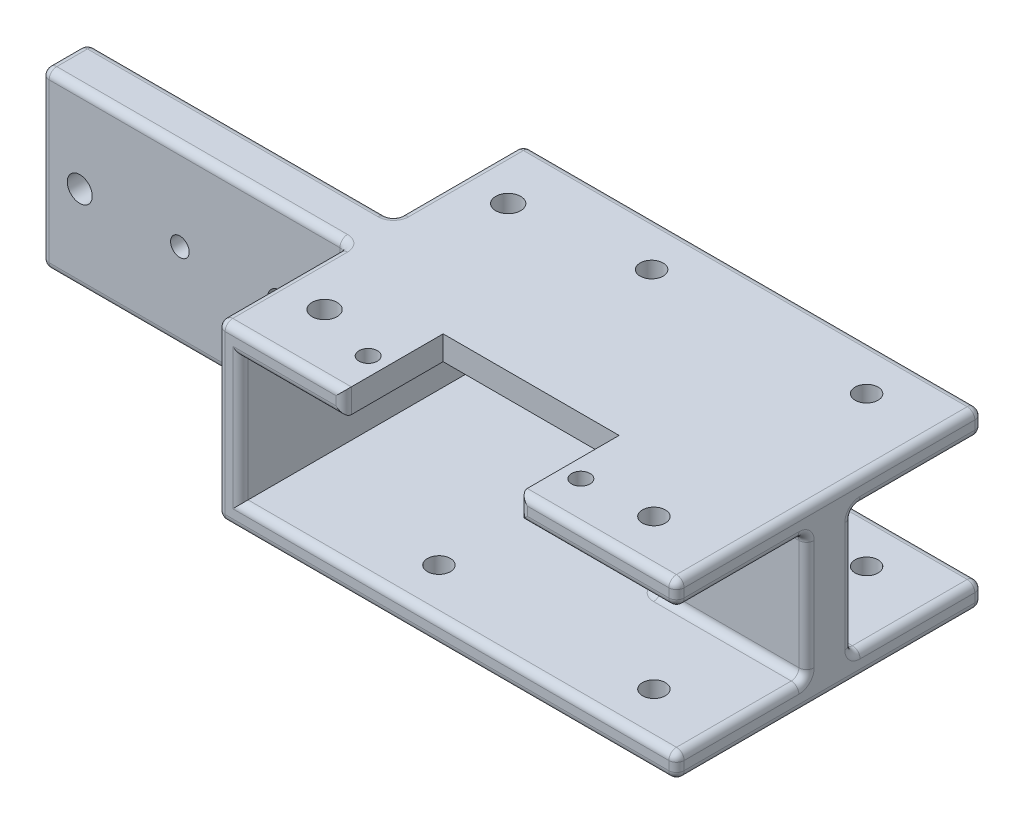
from build123d import *

# Parameters (mm, degrees)
SKETCH1_W                 = 60
SKETCH1_H                 = 40
BOSS_EXTRUDE1_DEPTH       = 3.15
BOSS_EXTRUDE2_START       = 16.4
SKETCH1_2_W               = 60
SKETCH1_2_H               = 40
BOSS_EXTRUDE2_DEPTH       = 3.15
SKETCH2_W                 = 3
SKETCH2_H                 = 40
SKETCH2_W_2               = 20
SKETCH2_H_2               = 6
BOSS_EXTRUDE3_DEPTH       = 16.4
SKETCH3_W                 = 6
SKETCH3_H                 = 22.7
BOSS_EXTRUDE4_DEPTH       = 40
M2_CLEARANCE_HOLE1_D      = 2.4
M2_CLEARANCE_HOLE1_DEPTH  = 5
M2_CLEARANCE_HOLE1_TIP    = 0.721032743
F_3_0MM_DOWEL_HOLE1_D     = 3
SKETCH5_W                 = 23
SKETCH5_H                 = 13
CUT_EXTRUDE1_DEPTH        = 7
FILLET1_R                 = 1
F_4_CLEARANCE_HOLE1_D     = 3.2639
F_2_CLEARANCE_HOLE1_D     = 2.4384
F_4_CLEARANCE_HOLE2_D     = 3.2639
F_4_CLEARANCE_HOLE2_DEPTH = 10
F_4_CLEARANCE_HOLE2_TIP   = 0.980574487


with BuildPart() as part:
    # Sketch1 → Boss-Extrude1 (new body)
    with BuildSketch(Plane(origin=(0, 0, 0), x_dir=(1, 0, 0), z_dir=(0, 1, 0))):
        with Locations((30, 0)):
            Rectangle(SKETCH1_W, SKETCH1_H)
    extrude(amount=-BOSS_EXTRUDE1_DEPTH)



with BuildPart() as body_2:
    # Sketch1<2> → Boss-Extrude2 (new body)
    with BuildSketch(Plane(origin=(0, 0, 0), x_dir=(1, 0, 0), z_dir=(0, 1, 0)).offset(BOSS_EXTRUDE2_START)):
        with Locations((30, 0)):
            Rectangle(SKETCH1_2_W, SKETCH1_2_H)
    extrude(amount=BOSS_EXTRUDE2_DEPTH)


with BuildPart() as part_1:
    add(part.part)

    add(body_2.part)  # Boss-Extrude3 merges body 2
    # Sketch2 → Boss-Extrude3 (add)
    with BuildSketch(Plane(origin=(0, 0, 0), x_dir=(1, 0, 0), z_dir=(0, 1, 0))):
        with Locations((1.5, 0)):
            Rectangle(SKETCH2_W, SKETCH2_H)
        with Locations((50, 0)):
            Rectangle(SKETCH2_W_2, SKETCH2_H_2)
    extrude(amount=BOSS_EXTRUDE3_DEPTH)

    # Sketch3 → Boss-Extrude4 (add)
    with BuildSketch(Plane.ZY):
        with Locations((0, 8.2)):
            Rectangle(SKETCH3_W, SKETCH3_H)
    extrude(amount=BOSS_EXTRUDE4_DEPTH)

    # M2 Clearance Hole1
    with Locations(Plane(origin=(0, 19.55, 0), x_dir=(1, 0, 0), z_dir=(0, 1, 0))):
        with Locations((14.1, -14.4), (41.9, -14.4)):
            Hole(M2_CLEARANCE_HOLE1_D / 2, depth=M2_CLEARANCE_HOLE1_DEPTH)
            with Locations((0, 0, -(M2_CLEARANCE_HOLE1_DEPTH + M2_CLEARANCE_HOLE1_TIP / 2))):  # 118° drill point
                Cone(0, M2_CLEARANCE_HOLE1_D / 2, M2_CLEARANCE_HOLE1_TIP, mode=Mode.SUBTRACT)

    # Ø3.0mm Dowel Hole1 (through all)
    with Locations(Plane(origin=(0, 19.55, 0), x_dir=(1, 0, 0), z_dir=(0, 1, 0))):
        with Locations((50.95, -13.9), (22.85, 13.9), (50.95, 13.9), (22.85, -13.9)):
            Hole(F_3_0MM_DOWEL_HOLE1_D / 2)

    # Sketch5 → Cut-Extrude1 (cut)
    with BuildSketch(Plane(origin=(0, 19.55, 0), x_dir=(1, 0, 0), z_dir=(0, 1, 0))):
        with Locations((28, -13.5)):
            Rectangle(SKETCH5_W, SKETCH5_H)
    extrude(amount=-CUT_EXTRUDE1_DEPTH, mode=Mode.SUBTRACT)

    # Fillet1
    fillet1_edges = [part_1.edges().sort_by_distance(p)[0] for p in [
        (60, -3.15, 0),
        (49.75, 19.55, 20),
        (49.75, 16.4, 20),
        (16.5, 17.975, 20),
        (39.5, 17.975, 20),
        (30, -3.15, -20),
        (31.5, 0, 20),
        (3, 8.2, 20),
        (3, 8.2, -20),
        (9.75, 16.4, 20),
        (60, 16.4, 11.5),
        (60, 17.975, 20),
        (31.5, 16.4, -20),
        (60, 17.975, -20),
        (0, 19.55, -11.5),
        (8.25, 19.55, 20),
        (60, 19.55, 0),
        (30, 19.55, -20),
        (60, 16.4, -11.5),
        (60, 0, -11.5),
        (60, 8.2, 3),
        (60, 8.2, -3),
        (50, 0, -3),
        (40, 8.2, -3),
        (40, 0, 0),
        (40, 8.2, 3),
        (50, 0, 3),
        (50, 16.4, 3),
        (50, 16.4, -3),
        (40, 16.4, 0),
        (0, -3.15, -11.5),
        (31.5, 0, -20),
        (0, 19.55, 11.5),
        (0, -3.15, 11.5),
        (60, 0, 11.5),
        (0, 8.2, -3),
        (-20, 19.55, -3),
        (-20, -3.15, -3),
        (0, 8.2, 3),
        (-20, -3.15, 3),
        (-20, 19.55, 3),
        (-40, 8.2, -3),
        (-40, -3.15, 0),
        (-40, 8.2, 3),
        (-40, 19.55, 0),
        (30, -3.15, 20),
        (0, 8.2, -20),
        (60, -1.575, -20),
        (60, -1.575, 20),
        (0, 8.2, 20),
    ]]
    fillet(fillet1_edges, radius=FILLET1_R)

    # #4 Clearance Hole1 (through all)
    with Locations(Plane.XY.offset(3)):
        with Locations((-35, 8.2), (-8.82, 8.2)):
            Hole(F_4_CLEARANCE_HOLE1_D / 2)

    # #2 Clearance Hole1 (through all)
    with Locations(Plane.XY.offset(3)):
        with Locations((-21.91, 8.2)):
            Hole(F_2_CLEARANCE_HOLE1_D / 2)

    # #4 Clearance Hole2
    with Locations(Plane(origin=(0, 19.55, 0), x_dir=(1, 0, 0), z_dir=(0, 1, 0))):
        with Locations((6, 12), (6, -12)):
            Hole(F_4_CLEARANCE_HOLE2_D / 2, depth=F_4_CLEARANCE_HOLE2_DEPTH)
            with Locations((0, 0, -(F_4_CLEARANCE_HOLE2_DEPTH + F_4_CLEARANCE_HOLE2_TIP / 2))):  # 118° drill point
                Cone(0, F_4_CLEARANCE_HOLE2_D / 2, F_4_CLEARANCE_HOLE2_TIP, mode=Mode.SUBTRACT)


solid = part_1.part
